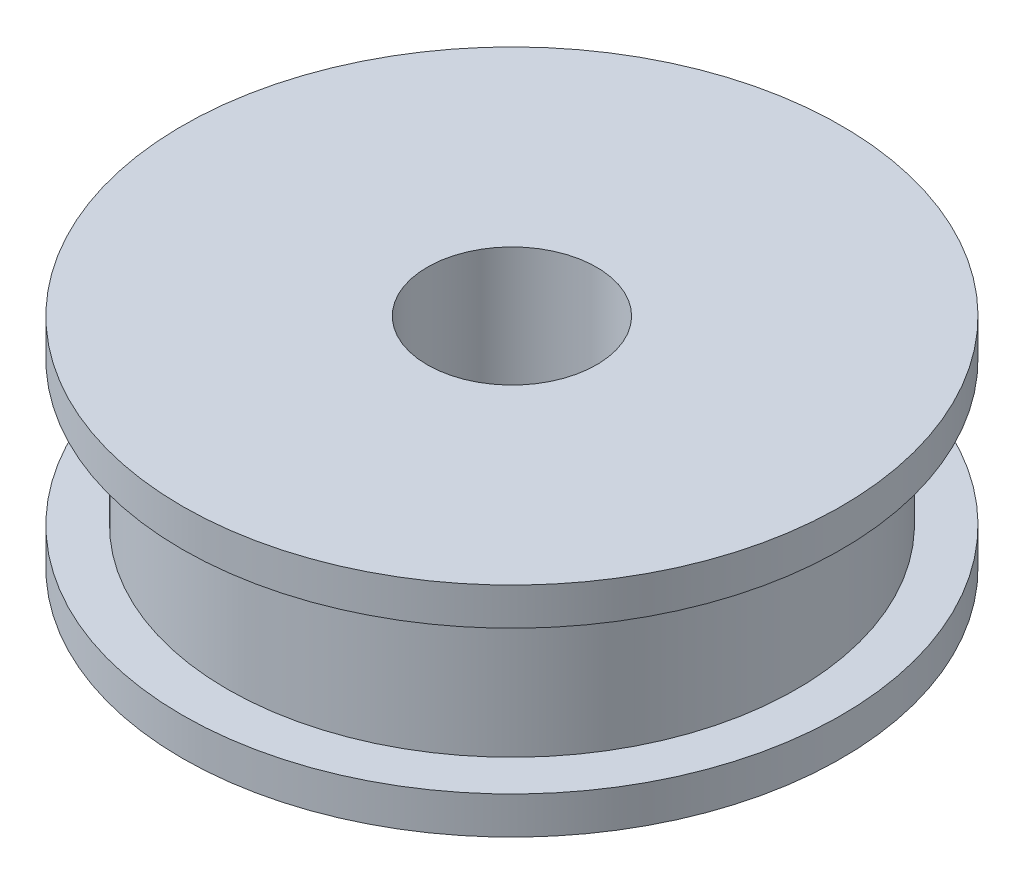
from build123d import *

# Parameters (mm, degrees)
SKETCH1_R           = 11.86815
BOSS_EXTRUDE1_DEPTH = 1.3462
SKETCH2_R           = 10.2489
BOSS_EXTRUDE2_DEPTH = 5.1689
SKETCH3_R           = 11.86815
BOSS_EXTRUDE4_DEPTH = 1.3462
SKETCH4_R           = 3.048
CUT_EXTRUDE1_DEPTH  = 19.533915035


with BuildPart() as part:
    # Sketch1 → Boss-Extrude1 (new body)
    with BuildSketch(Plane(origin=(0, 0, 0), x_dir=(1, 0, 0), z_dir=(0, 1, 0))):
        with Locations(Location((0, 0, 0), (0, 0, 270))):
            Circle(SKETCH1_R)
    extrude(amount=BOSS_EXTRUDE1_DEPTH)

    # Sketch2 → Boss-Extrude2 (add)
    with BuildSketch(Plane(origin=(0, 1.3462, 0), x_dir=(1, 0, 0), z_dir=(0, 1, 0))):
        with Locations(Location((0, 0, 0), (0, 0, 270))):
            Circle(SKETCH2_R)
    extrude(amount=BOSS_EXTRUDE2_DEPTH)

    # Sketch3 → Boss-Extrude4 (add)
    with BuildSketch(Plane(origin=(0, 6.5151, 0), x_dir=(1, 0, 0), z_dir=(0, 1, 0))):
        with Locations(Location((0, 0, 0), (0, 0, 270))):
            Circle(SKETCH3_R)
    extrude(amount=BOSS_EXTRUDE4_DEPTH)

    # Sketch4 → Cut-Extrude1 (cut, through all)
    with BuildSketch(Plane(origin=(0, 7.8613, 0), x_dir=(1, 0, 0), z_dir=(0, 1, 0))):
        with Locations(Location((0, 0, 0), (0, 0, 270))):
            Circle(SKETCH4_R)
    extrude(amount=-CUT_EXTRUDE1_DEPTH, mode=Mode.SUBTRACT)


solid = part.part
